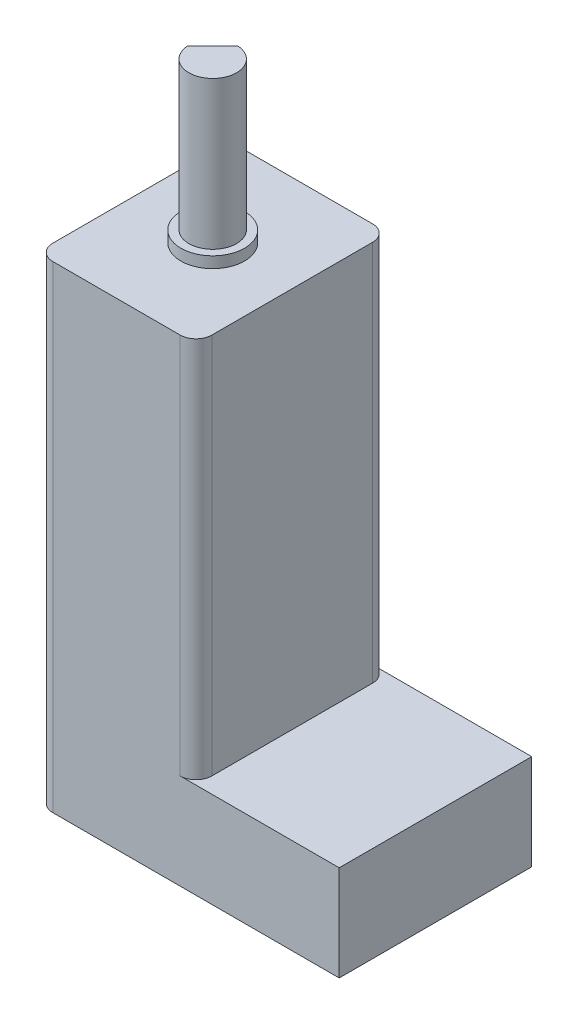
from build123d import *

# Parameters (mm, degrees)
SKETCH1_W           = 10
SKETCH1_H           = 12.1
BOSS_EXTRUDE1_DEPTH = 30
SKETCH2_R           = 2
BOSS_EXTRUDE2_DEPTH = 0.7
BOSS_EXTRUDE3_DEPTH = 9.3
FILLET1_R           = 1
SKETCH4_W           = 12.1
SKETCH4_H           = 6
BOSS_EXTRUDE4_DEPTH = 14


with BuildPart() as part:
    # Sketch1 → Boss-Extrude1 (new body)
    with BuildSketch(Plane(origin=(0, 0, 0), x_dir=(1, 0, 0), z_dir=(0, 1, 0))):
        Rectangle(SKETCH1_W, SKETCH1_H)
    extrude(amount=BOSS_EXTRUDE1_DEPTH)

    # Sketch2 → Boss-Extrude2 (add)
    with BuildSketch(Plane(origin=(0, 30, 0), x_dir=(1, 0, 0), z_dir=(0, 1, 0))):
        with Locations(Location((0, 0, 0), (0, 0, 270))):
            Circle(SKETCH2_R)
    extrude(amount=BOSS_EXTRUDE2_DEPTH)

    # Sketch3 → Boss-Extrude3 (add)
    with BuildSketch(Plane(origin=(0, 30.7, 0), x_dir=(1, 0, 0), z_dir=(0, 1, 0))):
        with BuildLine():
            ThreePointArc((1.5, 0), (1.08976923, 1.030729365), (0.083462634, 1.497676196))
            Line((0.083462634, 1.497676196), (-1.497676196, -0.083462634))
            ThreePointArc((-1.497676196, -0.083462634), (0.041747489, -1.499418937), (1.5, 0))
        make_face()
    extrude(amount=BOSS_EXTRUDE3_DEPTH)

    # Fillet1
    fillet1_edges = [part.edges().sort_by_distance(p)[0] for p in [
        (5, 15, 6.05),
        (-5, 15, 6.05),
        (-5, 15, -6.05),
        (5, 15, -6.05),
    ]]
    fillet(fillet1_edges, radius=FILLET1_R)

    # Sketch4 → Boss-Extrude4 (add)
    with BuildSketch(Plane(origin=(0, 0, 0), x_dir=(0, 0, -1), z_dir=(1, 0, 0))):
        with Locations((0, 3)):
            Rectangle(SKETCH4_W, SKETCH4_H)
    extrude(amount=BOSS_EXTRUDE4_DEPTH)


solid = part.part
